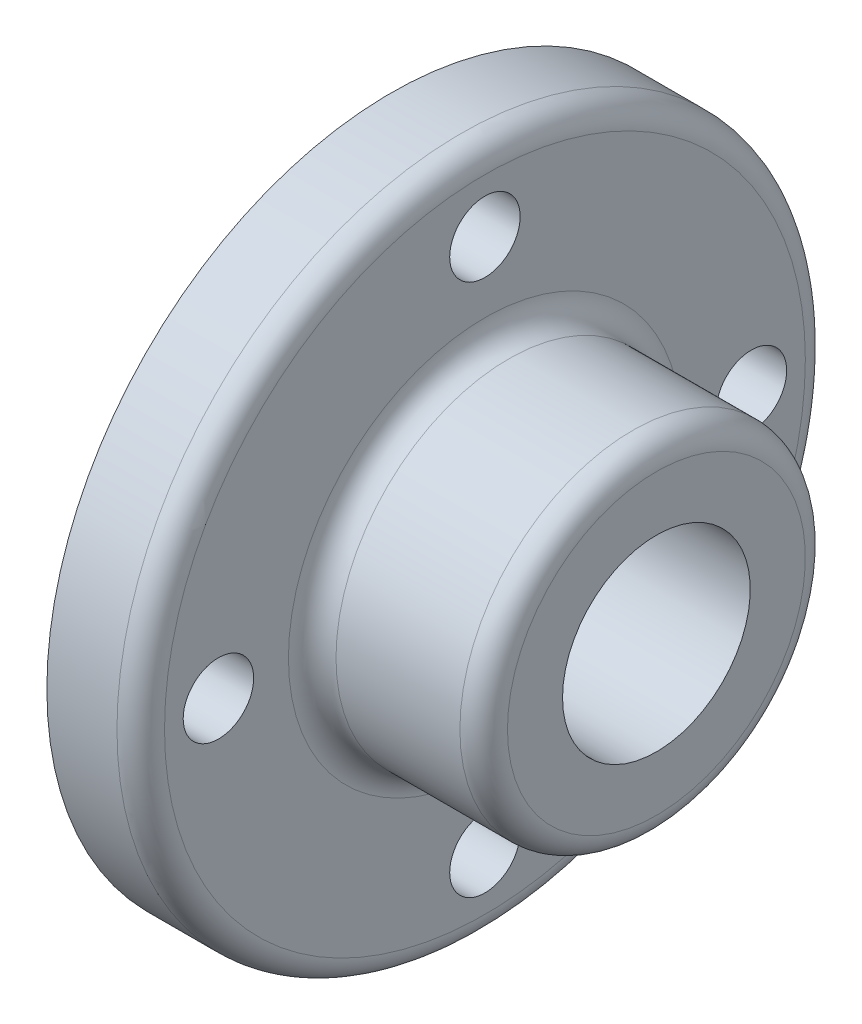
from build123d import *

# Parameters (mm, degrees)
SKETCH4_R          = 19.05
CUT_EXTRUDE3_DEPTH = 113.506231401
SKETCH6_R          = 7.1501
CUT_EXTRUDE5_DEPTH = 113.506231401
CIRPATTERN2_COUNT  = 4
FILLET1_R          = 4.826


with BuildPart() as part:
    # Sketch1 → Revolve1 (revolve)
    with BuildSketch(Plane.XY, mode=Mode.PRIVATE) as revolve1_sk:
        Polygon((-36.322, 35.052), (-1.524, 35.052), (-1.524, 0), (-55.372, 0), (-55.372, 69.85), (-36.322, 69.85), align=None)
    revolve(revolve1_sk.sketch.rotate(Axis((-88.771392405, 0, 0), (1, 0, 0)), 90), axis=Axis((-88.771392405, 0, 0), (1, 0, 0)))

    # Sketch4 → Cut-Extrude3 (cut, through all)
    with BuildSketch(Plane.ZY.offset(55.372)):
        Circle(SKETCH4_R)
    extrude(amount=-CUT_EXTRUDE3_DEPTH, mode=Mode.SUBTRACT)

    # Sketch6 → Cut-Extrude5 (cut, through all)
    with BuildSketch(Plane.ZY.offset(55.372)):
        with Locations((0, 54.082681536)):
            Circle(SKETCH6_R)
    cut_extrude5 = extrude(amount=-CUT_EXTRUDE5_DEPTH, mode=Mode.SUBTRACT)

    # CirPattern2: Cut-Extrude5 ×4 about axis
    cirpattern2_axis = Axis((0, 0, 0), (1, 0, 0))
    for i in range(1, CIRPATTERN2_COUNT):
        add(cut_extrude5.rotate(cirpattern2_axis, i * 360 / CIRPATTERN2_COUNT), mode=Mode.SUBTRACT)

    # Fillet1
    fillet1_edges = [part.edges().sort_by_distance(p)[0] for p in [
        (-36.322, 0, -35.052),
        (-1.524, 0, -35.052),
        (-36.322, 0, -69.85),
    ]]
    fillet(fillet1_edges, radius=FILLET1_R)


solid = part.part
